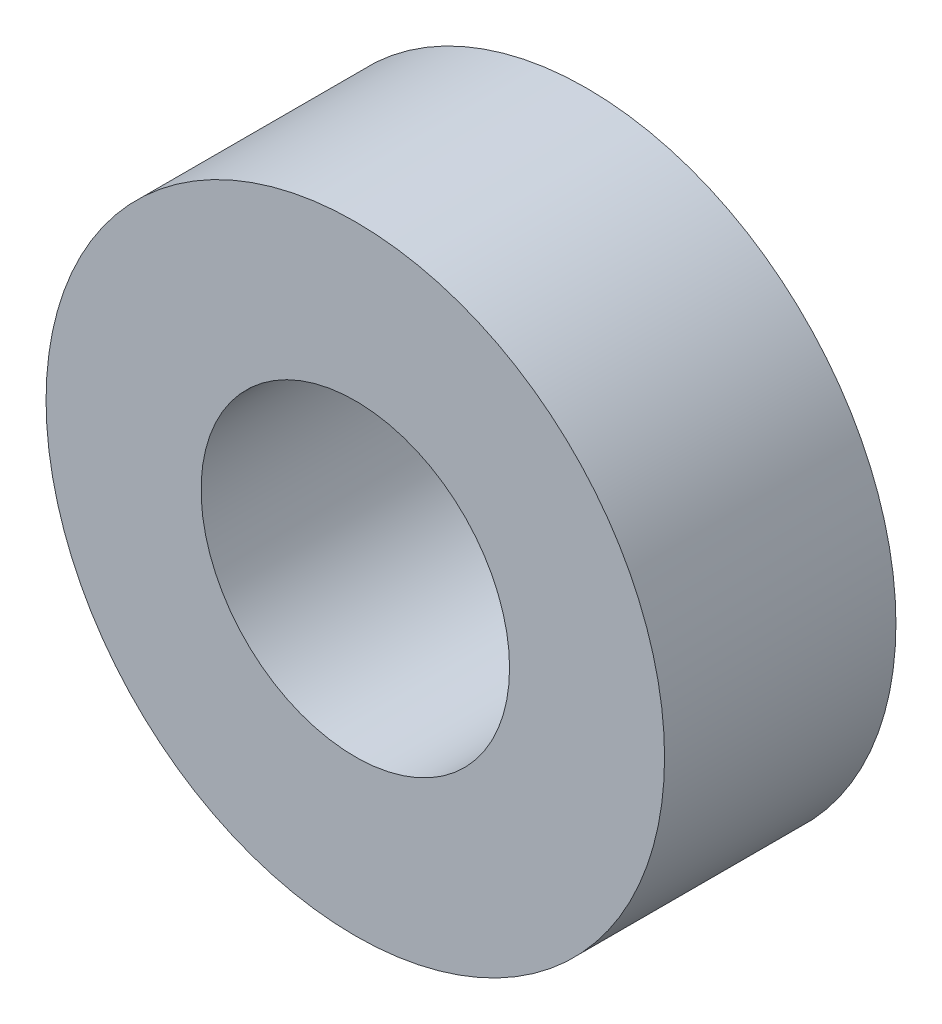
from build123d import *

# Parameters (mm, degrees)
SKETCH1_R      = 4.01
SKETCH1_R_2    = 2
EXTRUDE1_DEPTH = 1.5


with BuildPart() as part:
    # Sketch1 → Extrude1 (new, symmetric)
    with BuildSketch(Plane.XY):
        Circle(SKETCH1_R)
        Circle(SKETCH1_R_2, mode=Mode.SUBTRACT)
    extrude(amount=EXTRUDE1_DEPTH, both=True)


solid = part.part
